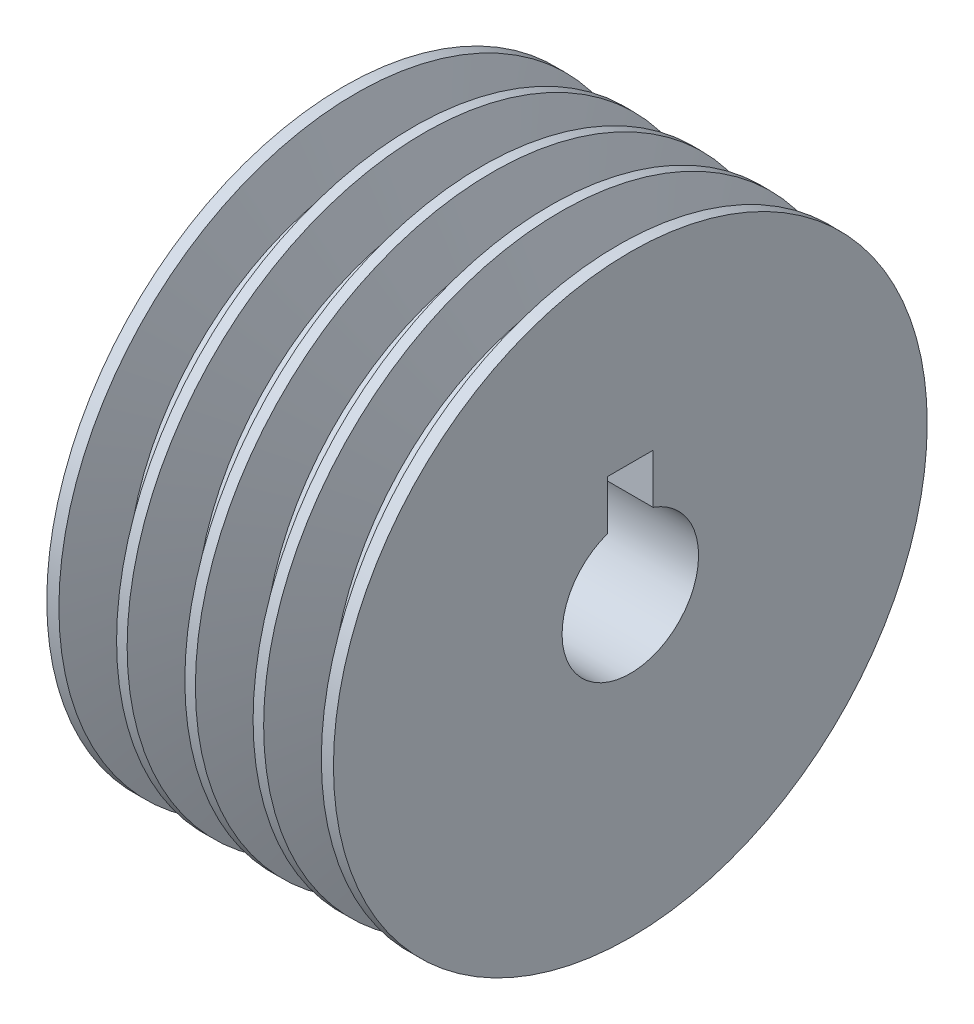
from build123d import *

# Parameters (mm, degrees)
SKETCH_1_R             = 65.25
EXTRUDE_1_DEPTH        = 31.5
PATTERN_LINEAR_1_COUNT = 4
PATTERN_LINEAR_1_PITCH = 15


with BuildPart() as part:
    # 草图1 → 凸台-拉伸1 (new, symmetric)
    with BuildSketch(Plane(origin=(0, 0, 0), x_dir=(0, 0, -1), z_dir=(1, 0, 0))):
        Circle(SKETCH_1_R)
        with BuildLine():
            Line((-5, 14.142135624), (-5, 25))
            Line((-5, 25), (5, 25))
            Line((5, 25), (5, 14.142135624))
            ThreePointArc((5, 14.142135624), (0, -15), (-5, 14.142135624))
        make_face(mode=Mode.SUBTRACT)
    extrude(amount=EXTRUDE_1_DEPTH, both=True)

    # 草图2 → 切除-旋转1 (revolve, cut)
    with BuildSketch(Plane.XY, mode=Mode.PRIVATE) as cut_revolve_1_sk:
        Polygon((-28.840759374, 65.25), (-16.159240626, 65.25), (-19.659856929, 53.8), (-25.340143071, 53.8), align=None)
    cut_revolve_1 = revolve(cut_revolve_1_sk.sketch.rotate(Axis((0, 0, 0), (1, 0, 0)), 90), axis=Axis((0, 0, 0), (1, 0, 0)), mode=Mode.SUBTRACT)

    # 阵列(线性)1: 切除-旋转1 ×4
    with Locations(*[(i * PATTERN_LINEAR_1_PITCH, 0, 0) for i in range(1, PATTERN_LINEAR_1_COUNT)]):
        add(cut_revolve_1, mode=Mode.SUBTRACT)


solid = part.part
